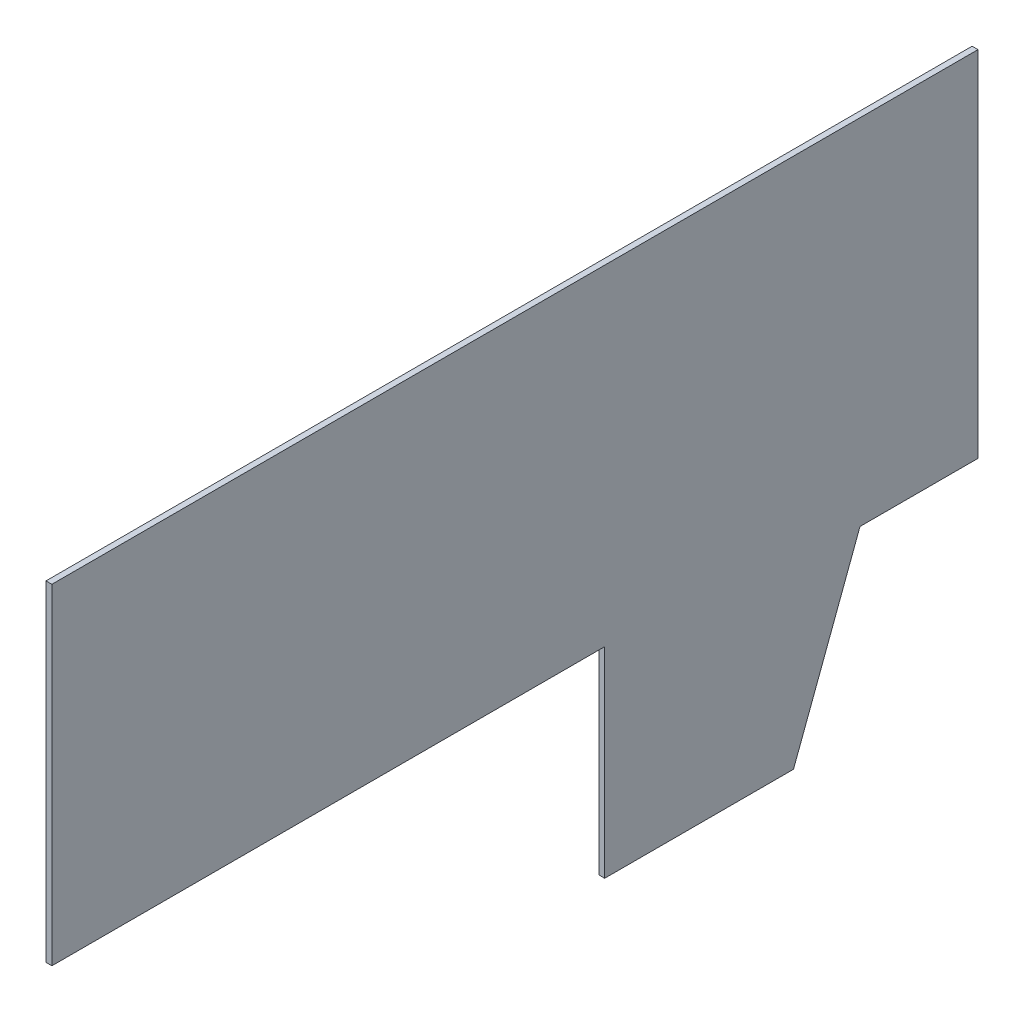
from build123d import *

# Parameters (mm, degrees)
SKETCH1_W           = 498.348
SKETCH1_H           = 177.8
BOSS_EXTRUDE1_DEPTH = 1.5875
BOSS_EXTRUDE2_DEPTH = 3.175


with BuildPart() as part:
    # Sketch1 → Boss-Extrude1 (new, symmetric)
    with BuildSketch(Plane(origin=(0, 0, 0), x_dir=(0, 0, -1), z_dir=(1, 0, 0))):
        Rectangle(SKETCH1_W, SKETCH1_H)
    extrude(amount=BOSS_EXTRUDE1_DEPTH, both=True)

    # Sketch2 → Boss-Extrude2 (add)
    with BuildSketch(Plane(origin=(1.5875, 0, 0), x_dir=(0, 0, -1), z_dir=(1, 0, 0))):
        Polygon((249.174, -101.6), (249.174, -88.9), (48.2854, -88.9), (48.2854, -196.85), (149.8854, -196.85), (185.674, -101.6), align=None)
    extrude(amount=-BOSS_EXTRUDE2_DEPTH)


solid = part.part
